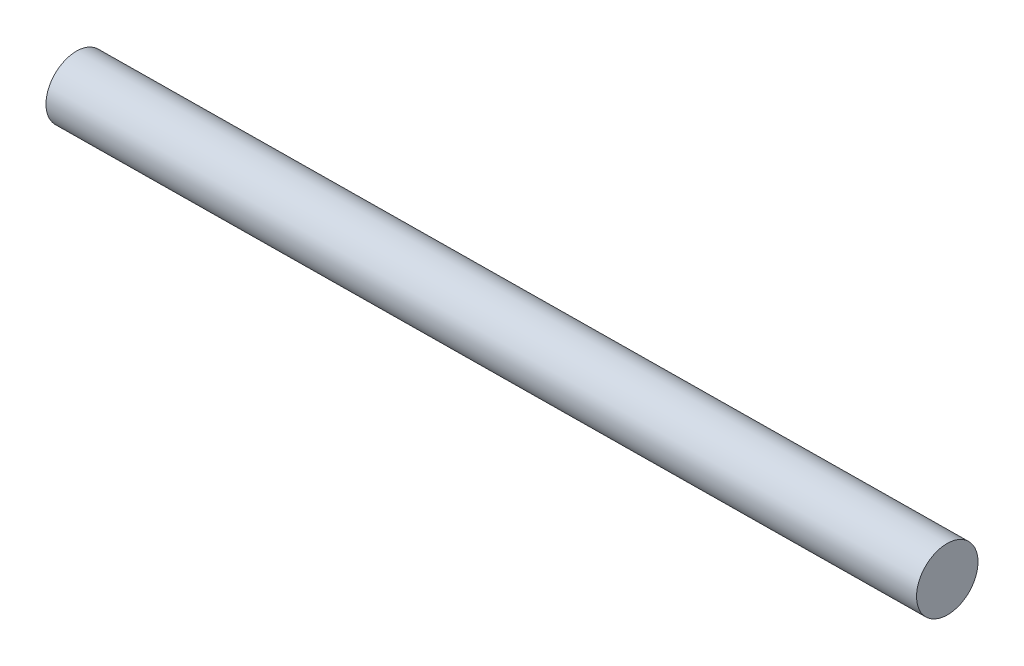
from build123d import *

# Parameters (mm, degrees)
SWEEP1_PROFILE_R = 9


with BuildPart() as part:
    # Sweep1: sweep along a path in Sketch1
    with BuildLine(Plane.XY) as sweep1_path:
        Line((0, 0), (255, 2.598435735))
    # Sweep1 profile (on start of the path) → Sweep1 (sweep)
    with BuildSketch(Plane(origin=(0, 0, 0), x_dir=(-0.010189415062129411, 0.9999480865628434, 0), z_dir=(0.9999480865628434, 0.010189415062129411, 0))):
        Circle(SWEEP1_PROFILE_R)
    sweep(path=sweep1_path.line)


solid = part.part
